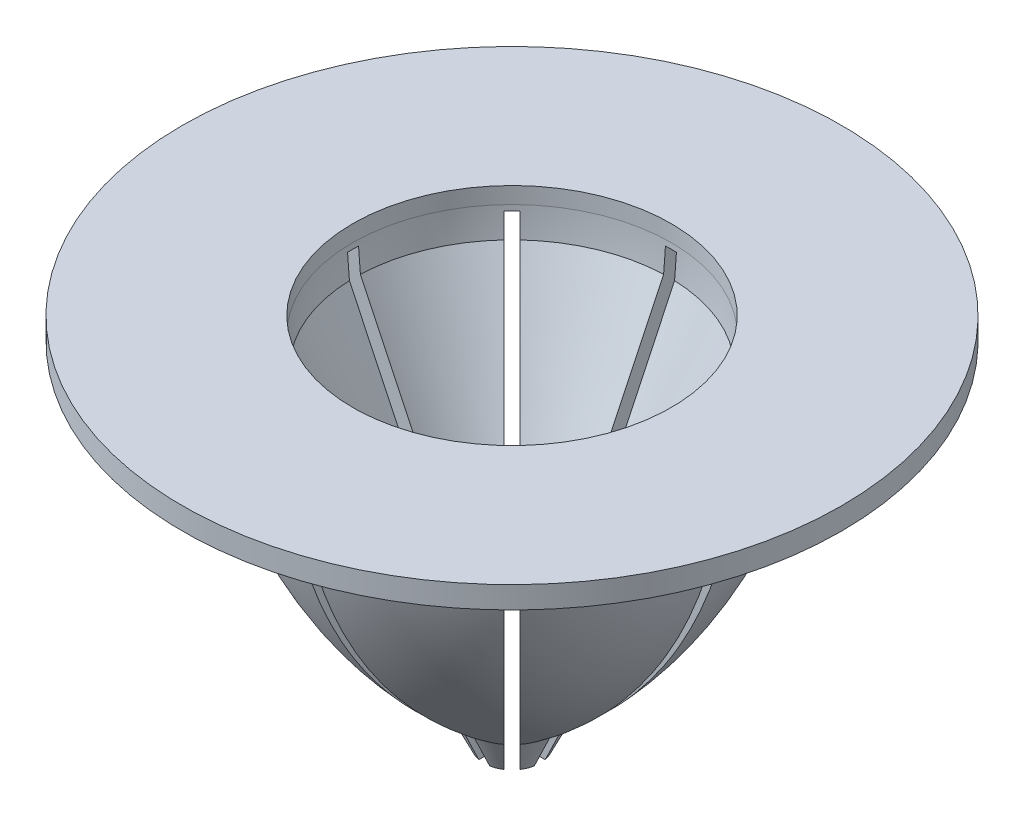
from build123d import *
from build123d.topology import SkipClean

# Parameters (mm, degrees)
CUT_EXTRUDE_2_DEPTH      = 57.308870736
CUT_EXTRUDE_2_DEPTH_BACK = 57.308870736
CUT_EXTRUDE_3_DEPTH      = 56.878114015
CUT_EXTRUDE_3_DEPTH_BACK = 56.878114015
SKETCH_10_W              = 1
SKETCH_10_H              = 46.329970166
CUT_EXTRUDE_4_DEPTH      = 56.595507527
CUT_EXTRUDE_4_DEPTH_BACK = 56.595507527
CUT_EXTRUDE_5_DEPTH      = 54.141321083
CUT_EXTRUDE_5_DEPTH_BACK = 54.141321083
SKETCH_12_W              = 66.545241491
SKETCH_12_H              = 1
CUT_EXTRUDE_6_DEPTH      = 54.141321089
CUT_EXTRUDE_6_DEPTH_BACK = 54.141321089
SKETCH_13_W              = 45.352631843
SKETCH_13_H              = 1


with BuildPart() as part:
    # 草图1 → 旋转1 (revolve)
    with BuildSketch(Plane.XY, mode=Mode.PRIVATE) as revolve_1_sk:
        with BuildLine():
            Line((20, 0), (30, 0))
            Line((30, 0), (30, 2))
            Line((30, 2), (14.5, 2))
            Line((14.5, 2), (14.5, 0.5))
            ThreePointArc((14.5, 0.5), (14.426596555, -0.826501206), (14.309182237, -2.149833134))
            Line((14.309182237, -2.149833134), (9.517031236, -12.232954146))
            Line((9.517031236, -12.232954146), (0.187039022, -31.864105278))
            Line((0.187039022, -31.864105278), (0.187039022, -37.022816257))
            Line((0.187039022, -37.022816257), (4, -29))
            ThreePointArc((4, -29), (15.142579617, -16.23383703), (20, 0))
        make_face()
    revolve(revolve_1_sk.sketch.rotate(Axis((0, 0, 0), (0, -1, 0)), 180), axis=Axis((0, 0, 0), (0, -1, 0)))

    # 草图4 → 切除-拉伸2 (cut, two sides: drawn at the far end of the back side and taken through both)
    with SkipClean():  # the faces are left unmerged after this step: merging them gives an invalid solid
        with BuildSketch(Plane(origin=(0, 0, 0), x_dir=(0, 0, -1), z_dir=(1, 0, 0)).offset(-CUT_EXTRUDE_2_DEPTH_BACK)):
            Polygon((-0.5, -29), (-0.5, 0), (0.5, 0), (0.5, -29), (0.5, -40.220154787), (-0.5, -40.220154787), align=None)
        extrude(amount=CUT_EXTRUDE_2_DEPTH + CUT_EXTRUDE_2_DEPTH_BACK, mode=Mode.SUBTRACT)

    # 草图10 → 切除-拉伸3 (cut, two sides: drawn at the far end of the back side and taken through both)
    with SkipClean():  # the faces are left unmerged after this step: merging them gives an invalid solid
        with BuildSketch(Plane.XY.offset(-CUT_EXTRUDE_3_DEPTH_BACK)):
            with Locations((0, -23.164985083)):
                Rectangle(SKETCH_10_W, SKETCH_10_H)
        extrude(amount=CUT_EXTRUDE_3_DEPTH + CUT_EXTRUDE_3_DEPTH_BACK, mode=Mode.SUBTRACT)

    # 草图11 → 切除-拉伸4 (cut, two sides: drawn at the far end of the back side and taken through both)
    with SkipClean():  # the faces are left unmerged after this step: merging them gives an invalid solid
        with BuildSketch(Plane.XY.offset(-CUT_EXTRUDE_4_DEPTH_BACK)):
            Polygon((-0.5, -32), (-4.49285236, -32), (-4.49285236, -37.795617789), (7.071104628, -37.795617789), (7.071104628, -32), align=None)
        extrude(amount=CUT_EXTRUDE_4_DEPTH + CUT_EXTRUDE_4_DEPTH_BACK, mode=Mode.SUBTRACT)

    # 草图12 → 切除-拉伸5 (cut, two sides: drawn at the far end of the back side and taken through both)
    with SkipClean():  # the faces are left unmerged after this step: merging them gives an invalid solid
        with BuildSketch(Plane(origin=(0, 0, 0), x_dir=(0, -1, 0), z_dir=(-0.7071067811865438, 0, -0.7071067811865512)).offset(-CUT_EXTRUDE_5_DEPTH_BACK)):
            with Locations((33.272620745, 0)):
                Rectangle(SKETCH_12_W, SKETCH_12_H)
        extrude(amount=CUT_EXTRUDE_5_DEPTH + CUT_EXTRUDE_5_DEPTH_BACK, mode=Mode.SUBTRACT)

    # 草图13 → 切除-拉伸6 (cut, two sides: drawn at the far end of the back side and taken through both)
    with SkipClean():  # the faces are left unmerged after this step: merging them gives an invalid solid
        with BuildSketch(Plane(origin=(0, 0, 0), x_dir=(0, -1, 0), z_dir=(-0.7071067811865488, 0, 0.7071067811865464)).offset(-CUT_EXTRUDE_6_DEPTH_BACK)):
            with Locations((22.676315922, 0)):
                Rectangle(SKETCH_13_W, SKETCH_13_H)
        extrude(amount=CUT_EXTRUDE_6_DEPTH + CUT_EXTRUDE_6_DEPTH_BACK, mode=Mode.SUBTRACT)


solid = part.part
